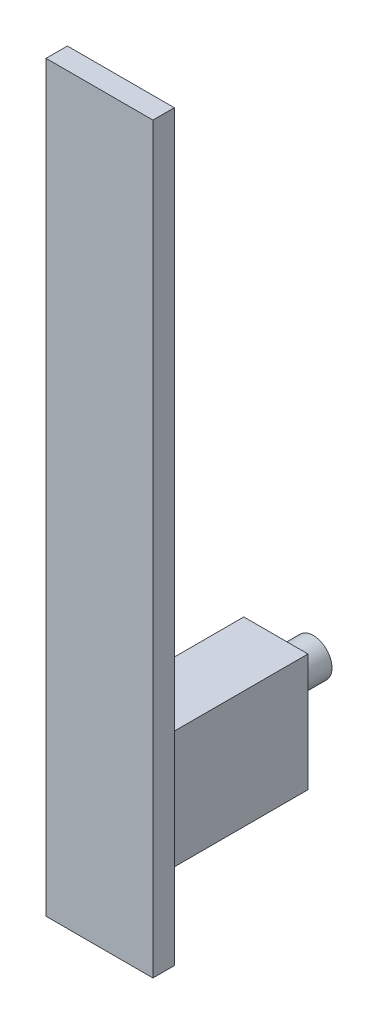
from build123d import *

# Parameters (mm, degrees)
SKIZZE1_W                       = 20
SKIZZE1_H                       = 139
AUFSATZ_LINEAR_AUSTRAGEN1_DEPTH = 4
SKIZZE7_R                       = 3.5
SCHNITT_LINEAR_AUSTRAGEN1_DEPTH = 3
SKIZZE8_W                       = 16
SKIZZE8_H                       = 45
AUFSATZ_LINEAR_AUSTRAGEN5_DEPTH = 2
SKIZZE9_W                       = 12
SKIZZE9_H                       = 22
AUFSATZ_LINEAR_AUSTRAGEN6_DEPTH = 27
SKIZZE10_R                      = 3.5
AUFSATZ_LINEAR_AUSTRAGEN7_DEPTH = 7


with BuildPart() as part:
    # Skizze1 → Aufsatz-Linear austragen1 (new body)
    with BuildSketch(Plane.XY):
        with Locations((10, 69.5)):
            Rectangle(SKIZZE1_W, SKIZZE1_H)
    extrude(amount=AUFSATZ_LINEAR_AUSTRAGEN1_DEPTH)

    # Skizze7 → Schnitt-Linear austragen1 (cut)
    with BuildSketch(Plane(origin=(0, 0, 0), x_dir=(-1, 0, 0), z_dir=(0, 0, -1))):
        with Locations((-10, 117)):
            Circle(SKIZZE7_R)
    extrude(amount=-SCHNITT_LINEAR_AUSTRAGEN1_DEPTH, mode=Mode.SUBTRACT)

    # Skizze8 → Aufsatz-Linear austragen5 (add)
    with BuildSketch(Plane(origin=(0, 0, 0), x_dir=(-1, 0, 0), z_dir=(0, 0, -1))):
        with Locations((-10, 22.5)):
            Rectangle(SKIZZE8_W, SKIZZE8_H)
    extrude(amount=AUFSATZ_LINEAR_AUSTRAGEN5_DEPTH)

    # Skizze9 → Aufsatz-Linear austragen6 (add)
    with BuildSketch(Plane(origin=(0, 0, -2), x_dir=(-1, 0, 0), z_dir=(0, 0, -1))):
        with Locations((-10, 23)):
            Rectangle(SKIZZE9_W, SKIZZE9_H)
    extrude(amount=AUFSATZ_LINEAR_AUSTRAGEN6_DEPTH)

    # Skizze10 → Aufsatz-Linear austragen7 (add)
    with BuildSketch(Plane(origin=(0, 0, -29), x_dir=(-1, 0, 0), z_dir=(0, 0, -1))):
        with Locations((-10, 27)):
            Circle(SKIZZE10_R)
    extrude(amount=AUFSATZ_LINEAR_AUSTRAGEN7_DEPTH)


solid = part.part
